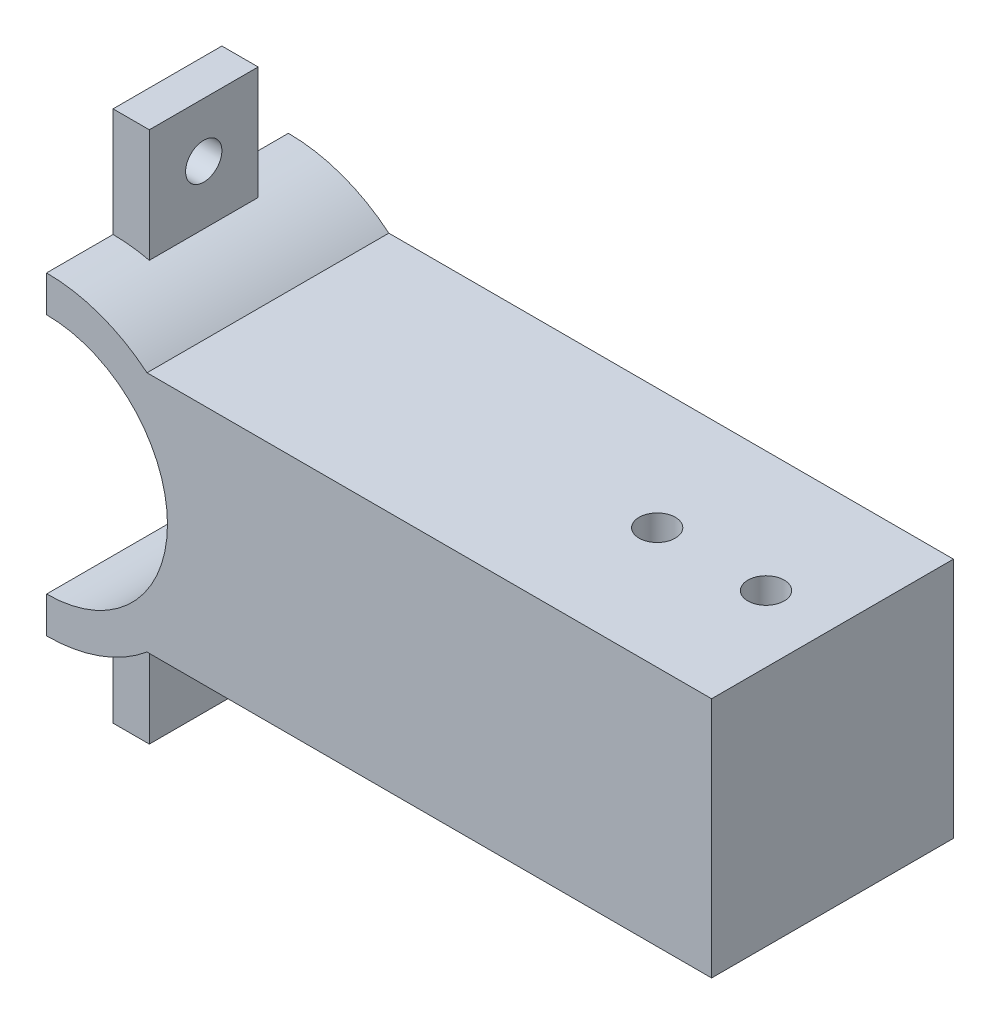
from build123d import *

# Parameters (mm, degrees)
EXTRUDE_1_DEPTH     = 20
SKETCH_2_R          = 1.5
CUT_EXTRUDE_1_DEPTH = 63.880839689
SKETCH_6_R          = 1.5
EXTRUDE_2_DEPTH     = 3


with BuildPart() as part:
    # Эскиз1 → Бобышка-Вытянуть1 (new body)
    with BuildSketch(Plane.XY):
        with BuildLine():
            Line((0, 10), (0, 13))
            ThreePointArc((0, 13), (4.415880433, 12.227019261), (8.306623863, 10))
            Line((8.306623863, 10), (55, 10))
            Line((55, 10), (55, 0))
            Line((55, 0), (55, -10))
            Line((55, -10), (8.306623863, -10))
            ThreePointArc((8.306623863, -10), (4.415880433, -12.227019261), (0, -13))
            Line((0, -13), (0, -10))
            ThreePointArc((0, -10), (10, 0), (0, 10))
        make_face()
    extrude(amount=EXTRUDE_1_DEPTH)

    # Эскиз2 → Вырез-Вытянуть1 (cut, through all)
    with BuildSketch(Plane(origin=(0, 10, 0), x_dir=(1, 0, 0), z_dir=(0, 1, 0))):
        with Locations(Location((40.5, -10, 0), (0, 0, 270))):
            Circle(SKETCH_2_R)
        with Locations(Location((49.5, -10, 0), (0, 0, 270))):
            Circle(SKETCH_2_R)
    extrude(amount=-CUT_EXTRUDE_1_DEPTH, mode=Mode.SUBTRACT)

    # Эскиз6 → Бобышка-Вытянуть2 (add)
    # profile 1 of 2: a face of its own
    with BuildSketch(Plane.ZY):
        Polygon((10, 10), (5.5, 10), (5.5, 22), (14.5, 22), (14.5, 10), align=None)
        with Locations((10, 17.5)):
            Circle(SKETCH_6_R, mode=Mode.SUBTRACT)
    # profile 2 of 2: a face of its own
    with BuildSketch(Plane.ZY):
        Polygon((10, -10), (5.5, -10), (5.5, -22), (14.5, -22), (14.5, -10), align=None)
        with Locations((10, -17.5)):
            Circle(SKETCH_6_R, mode=Mode.SUBTRACT)
    extrude(amount=-EXTRUDE_2_DEPTH)


solid = part.part
